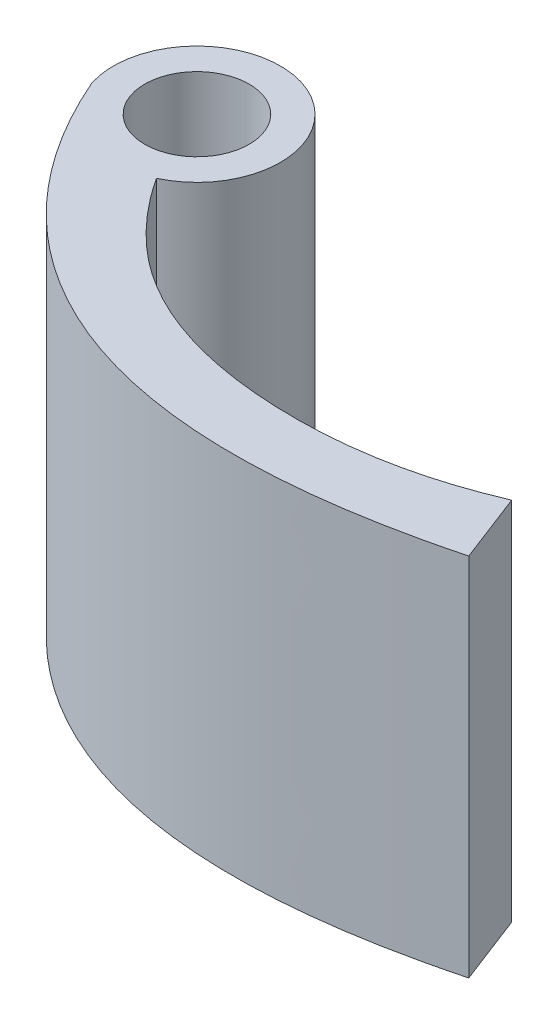
from build123d import *

# Parameters (mm, degrees)
SKETCH1_R           = 2.5
BOSS_EXTRUDE1_DEPTH = 17.5


with BuildPart() as part:
    # Sketch1 → Boss-Extrude1 (new body)
    with BuildSketch(Plane(origin=(0, 0, 0), x_dir=(1, 0, 0), z_dir=(0, 1, 0))):
        with BuildLine():
            Line((23.541879595, -8.468455204), (24.8316558, -11.814901575))
            add(Edge.make_bspline(
                [(-3.805568845, -1.231927661), (-3.528946614, -1.867614728), (-2.918738419, -3.125576948), (-1.515087953, -5.45453999), (0.623426846, -8.045621597), (3.781873409, -10.498015789), (7.418729789, -12.189728632), (11.38983742, -13.110549791), (15.60959038, -13.326716755), (19.330752619, -12.977312299), (22.419560669, -12.410056853), (24.038619789, -12.023782628), (24.8316558, -11.814901575)],
                knots=[0, 0, 0, 0, 0.0625, 0.125, 0.25, 0.375, 0.5, 0.625, 0.75, 0.875, 0.9375, 1, 1, 1, 1], degree=3))
            ThreePointArc((-3.805568845, -1.231927661), (1.597426024, 3.667182856), (1.689614598, -3.625631326))
            add(Edge.make_bspline(
                [(1.689614598, -3.625631326), (2.720324256, -5.218487164), (7.805226841, -10.039422802), (19.040924986, -10.402845427), (23.541879595, -8.468455204)],
                knots=[0.175056288, 0.175056288, 0.175056288, 0.314867668, 0.704791976, 1, 1, 1], degree=2))
        make_face()
        with Locations(Location((0, 0, 0), (0, 0, 270))):
            Circle(SKETCH1_R, mode=Mode.SUBTRACT)
    extrude(amount=BOSS_EXTRUDE1_DEPTH)


solid = part.part
